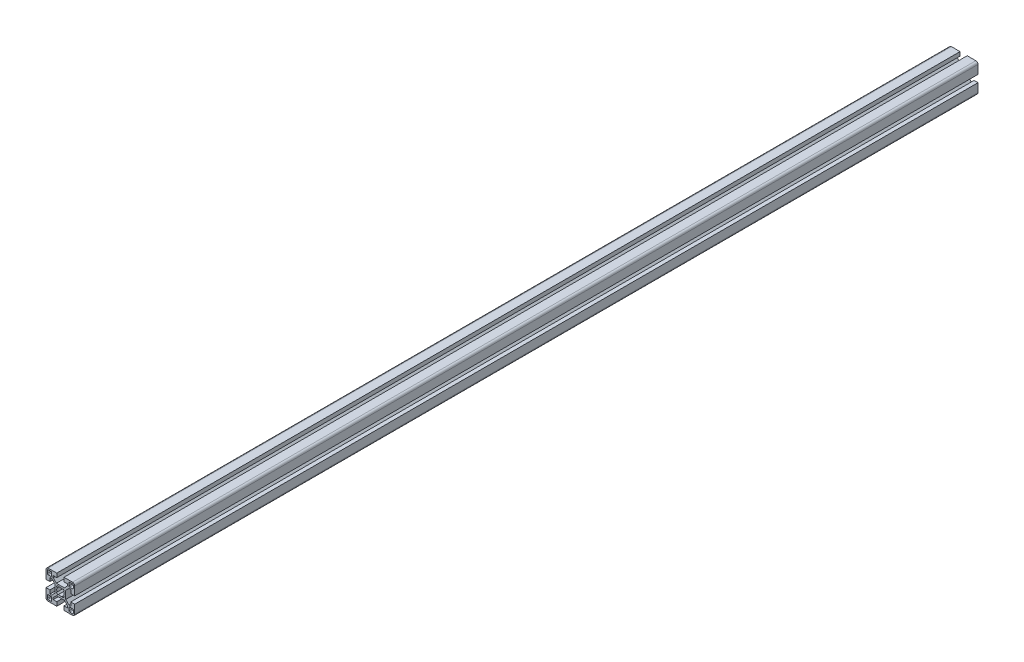
from build123d import *

# Parameters (mm, degrees)
BOSS_EXTRUDE1_DEPTH = 629


with BuildPart() as part:
    # Sketch1 → Boss-Extrude1 (new, symmetric)
    with BuildSketch(Plane.XY):
        with BuildLine():
            Line((-5.555456352, -7.5), (5.555456352, -7.5))
            Line((5.555456352, -7.5), (10, -11.944543648))
            Line((10, -11.944543648), (10, -14.5))
            Line((10, -14.5), (5, -14.5))
            Line((5, -14.5), (5, -20))
            Line((5, -20), (17, -20))
            ThreePointArc((17, -20), (19.121320344, -19.121320344), (20, -17))
            Line((20, -17), (20, -5))
            Line((20, -5), (14.5, -5))
            Line((14.5, -5), (14.5, -10))
            Line((14.5, -10), (11.944543648, -10))
            Line((11.944543648, -10), (7.5, -5.555456352))
            Line((7.5, -5.555456352), (7.5, 5.555456352))
            Line((7.5, 5.555456352), (11.944543648, 10))
            Line((11.944543648, 10), (14.5, 10))
            Line((14.5, 10), (14.5, 5))
            Line((14.5, 5), (20, 5))
            Line((20, 5), (20, 17))
            ThreePointArc((20, 17), (19.121320344, 19.121320344), (17, 20))
            Line((17, 20), (5, 20))
            Line((5, 20), (5, 14.5))
            Line((5, 14.5), (10, 14.5))
            Line((10, 14.5), (10, 11.944543648))
            Line((10, 11.944543648), (5.555456352, 7.5))
            Line((5.555456352, 7.5), (-5.555456352, 7.5))
            Line((-5.555456352, 7.5), (-10, 11.944543648))
            Line((-10, 11.944543648), (-10, 14.5))
            Line((-10, 14.5), (-5, 14.5))
            Line((-5, 14.5), (-5, 20))
            Line((-5, 20), (-17, 20))
            ThreePointArc((-17, 20), (-19.121320344, 19.121320344), (-20, 17))
            Line((-20, 17), (-20, 5))
            Line((-20, 5), (-14.5, 5))
            Line((-14.5, 5), (-14.5, 10))
            Line((-14.5, 10), (-11.944543648, 10))
            Line((-11.944543648, 10), (-7.5, 5.555456352))
            Line((-7.5, 5.555456352), (-7.5, -5.555456352))
            Line((-7.5, -5.555456352), (-11.944543648, -10))
            Line((-11.944543648, -10), (-14.5, -10))
            Line((-14.5, -10), (-14.5, -5))
            Line((-14.5, -5), (-20, -5))
            Line((-20, -5), (-20, -17))
            ThreePointArc((-20, -17), (-19.121320344, -19.121320344), (-17, -20))
            Line((-17, -20), (-5, -20))
            Line((-5, -20), (-5, -14.5))
            Line((-5, -14.5), (-10, -14.5))
            Line((-10, -14.5), (-10, -11.944543648))
            Line((-10, -11.944543648), (-5.555456352, -7.5))
        make_face()
        with BuildLine():
            Line((-18, 13), (-18, 17))
            ThreePointArc((-18, 17), (-17.707106781, 17.707106781), (-17, 18))
            Line((-17, 18), (-13, 18))
            ThreePointArc((-13, 18), (-12.292893219, 17.707106781), (-12, 17))
            Line((-12, 17), (-12, 13))
            ThreePointArc((-12, 13), (-12.292893219, 12.292893219), (-13, 12))
            Line((-13, 12), (-17, 12))
            ThreePointArc((-17, 12), (-17.707106781, 12.292893219), (-18, 13))
        make_face(mode=Mode.SUBTRACT)
        with BuildLine():
            Line((-18, -17), (-18, -13))
            ThreePointArc((-18, -13), (-17.707106781, -12.292893219), (-17, -12))
            Line((-17, -12), (-13, -12))
            ThreePointArc((-13, -12), (-12.292893219, -12.292893219), (-12, -13))
            Line((-12, -13), (-12, -17))
            ThreePointArc((-12, -17), (-12.292893219, -17.707106781), (-13, -18))
            Line((-13, -18), (-17, -18))
            ThreePointArc((-17, -18), (-17.707106781, -17.707106781), (-18, -17))
        make_face(mode=Mode.SUBTRACT)
        with BuildLine():
            Line((18, -13), (18, -17))
            ThreePointArc((18, -17), (17.707106781, -17.707106781), (17, -18))
            Line((17, -18), (13, -18))
            ThreePointArc((13, -18), (12.292893219, -17.707106781), (12, -17))
            Line((12, -17), (12, -13))
            ThreePointArc((12, -13), (12.292893219, -12.292893219), (13, -12))
            Line((13, -12), (17, -12))
            ThreePointArc((17, -12), (17.707106781, -12.292893219), (18, -13))
        make_face(mode=Mode.SUBTRACT)
        with BuildLine():
            Line((18, 17), (18, 13))
            ThreePointArc((18, 13), (17.707106781, 12.292893219), (17, 12))
            Line((17, 12), (13, 12))
            ThreePointArc((13, 12), (12.292893219, 12.292893219), (12, 13))
            Line((12, 13), (12, 17))
            ThreePointArc((12, 17), (12.292893219, 17.707106781), (13, 18))
            Line((13, 18), (17, 18))
            ThreePointArc((17, 18), (17.707106781, 17.707106781), (18, 17))
        make_face(mode=Mode.SUBTRACT)
        with BuildLine():
            Line((-2.500434253, -4.444977902), (-3.631805103, -5.576348751))
            Line((-3.631805103, -5.576348751), (-5.576348751, -3.631805103))
            Line((-5.576348751, -3.631805103), (-4.444977902, -2.500434253))
            ThreePointArc((-4.444977902, -2.500434253), (-5.1, 0), (-4.444977902, 2.500434253))
            Line((-4.444977902, 2.500434253), (-5.576348751, 3.631805103))
            Line((-5.576348751, 3.631805103), (-3.631805103, 5.576348751))
            Line((-3.631805103, 5.576348751), (-2.500434253, 4.444977902))
            ThreePointArc((-2.500434253, 4.444977902), (0, 5.1), (2.500434253, 4.444977902))
            Line((2.500434253, 4.444977902), (3.631805103, 5.576348751))
            Line((3.631805103, 5.576348751), (5.576348751, 3.631805103))
            Line((5.576348751, 3.631805103), (4.444977902, 2.500434253))
            ThreePointArc((4.444977902, 2.500434253), (5.1, 0), (4.444977902, -2.500434253))
            Line((4.444977902, -2.500434253), (5.576348751, -3.631805103))
            Line((5.576348751, -3.631805103), (3.631805103, -5.576348751))
            Line((3.631805103, -5.576348751), (2.500434253, -4.444977902))
            ThreePointArc((2.500434253, -4.444977902), (0, -5.1), (-2.500434253, -4.444977902))
        make_face(mode=Mode.SUBTRACT)
    extrude(amount=BOSS_EXTRUDE1_DEPTH, both=True)


solid = part.part
